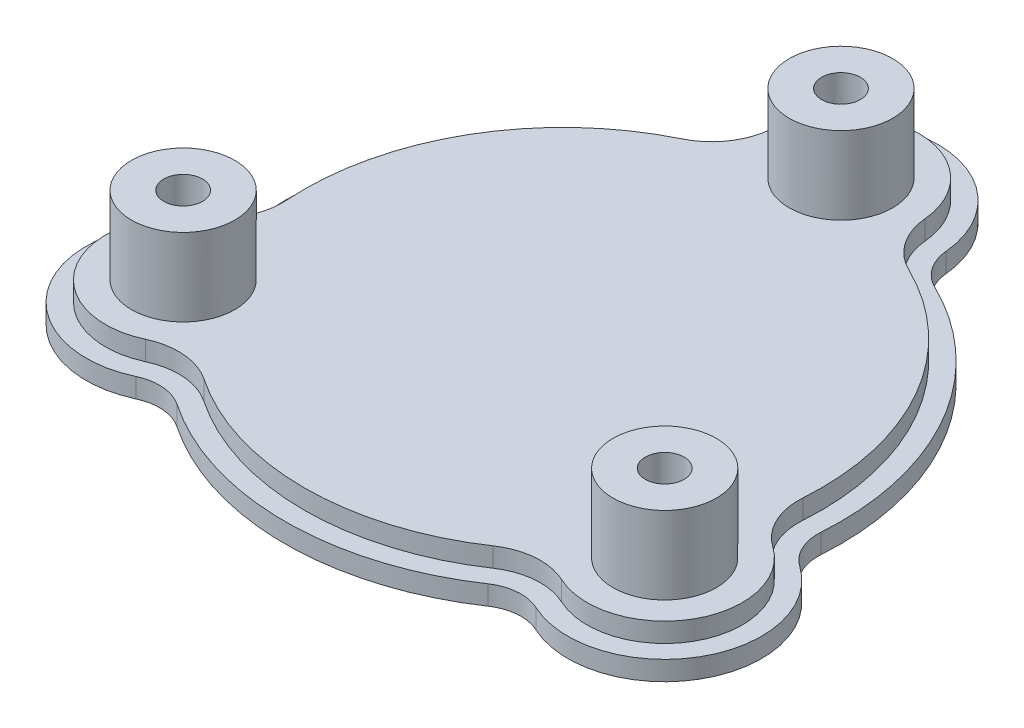
from build123d import *

# Parameters (mm, degrees)
SKETCH2_R             = 8
SKETCH2_R_2           = 3
BOSS_EXTRUDE2_DEPTH   = 6
BOSS_EXTRUDE2_2_DEPTH = 6
BOSS_EXTRUDE2_3_DEPTH = 6
SKETCH3_R             = 8
BOSS_EXTRUDE3_DEPTH   = 12
SKETCH3_4_R           = 8
CUT_EXTRUDE1_DEPTH    = 6
CUT_EXTRUDE3_DEPTH    = 9
SKETCH3_8_R           = 8
SKETCH3_8_R_2         = 6
BOSS_EXTRUDE4_DEPTH   = 12


with BuildPart() as part:
    # Sketch2 → Boss-Extrude2 (new body)
    with BuildSketch(Plane(origin=(0, 0, 0), x_dir=(1, 0, 0), z_dir=(0, 1, 0))):
        with Locations((0, 43)):
            Circle(SKETCH2_R)
        with Locations((0, 43)):
            Circle(SKETCH2_R_2, mode=Mode.SUBTRACT)
    extrude(amount=-BOSS_EXTRUDE2_DEPTH)



with BuildPart() as body_2:
    # Sketch2 → Boss-Extrude2 2 (new body)
    with BuildSketch(Plane(origin=(0, 0, 0), x_dir=(1, 0, 0), z_dir=(0, 1, 0))):
        with Locations((37.239092363, -21.5)):
            Circle(SKETCH2_R)
        with Locations((37.239092363, -21.5)):
            Circle(SKETCH2_R_2, mode=Mode.SUBTRACT)
    extrude(amount=-BOSS_EXTRUDE2_2_DEPTH)


with BuildPart() as body_3:
    # Sketch2 → Boss-Extrude2 3 (new body)
    with BuildSketch(Plane(origin=(0, 0, 0), x_dir=(1, 0, 0), z_dir=(0, 1, 0))):
        with Locations((-37.239092363, -21.5)):
            Circle(SKETCH2_R)
        with Locations((-37.239092363, -21.5)):
            Circle(SKETCH2_R_2, mode=Mode.SUBTRACT)
    extrude(amount=-BOSS_EXTRUDE2_3_DEPTH)


with BuildPart() as body_4:
    # Sketch3 → Boss-Extrude3 (new body)
    with BuildSketch(Plane.XZ.offset(6)):
        with BuildLine():
            ThreePointArc((-18.846153454, -38.65), (-16.147655157, -40.973517523), (-14.941453584, -44.323995772))
            ThreePointArc((-14.941453584, -44.323995772), (0, -58), (14.941453584, -44.323995772))
            ThreePointArc((14.941453584, -44.323995772), (16.147655157, -40.973517523), (18.846153454, -38.65))
            ThreePointArc((18.846153454, -38.65), (37.239092363, -21.5), (42.894958583, 3.003752345))
            ThreePointArc((42.894958583, 3.003752345), (43.557934635, 6.502479184), (45.856433127, 9.222319513))
            ThreePointArc((45.856433127, 9.222319513), (50.229473419, 29), (30.914979544, 35.101676259))
            ThreePointArc((30.914979544, 35.101676259), (27.410279478, 34.471038339), (24.048805129, 35.646247655))
            ThreePointArc((24.048805129, 35.646247655), (0, 43), (-24.048805129, 35.646247655))
            ThreePointArc((-24.048805129, 35.646247655), (-27.410279478, 34.471038339), (-30.914979544, 35.101676259))
            ThreePointArc((-30.914979544, 35.101676259), (-50.229473419, 29), (-45.856433127, 9.222319513))
            ThreePointArc((-45.856433127, 9.222319513), (-43.557934635, 6.502479184), (-42.894958583, 3.003752345))
            ThreePointArc((-42.894958583, 3.003752345), (-37.239092363, -21.5), (-18.846153454, -38.65))
        make_face()
        with Locations((0, -43)):
            Circle(SKETCH3_R, mode=Mode.SUBTRACT)
        with Locations((-37.239092363, 21.5)):
            Circle(SKETCH3_R, mode=Mode.SUBTRACT)
        with Locations((37.239092363, 21.5)):
            Circle(SKETCH3_R, mode=Mode.SUBTRACT)
    extrude(amount=BOSS_EXTRUDE3_DEPTH)

    # Sketch3<4> → Cut-Extrude1 (cut)
    with BuildSketch(Plane.XZ.offset(6)):
        with BuildLine():
            ThreePointArc((11.953162867, -44.059196617), (13.676307972, -39.272799119), (17.531305538, -35.953488372))
            ThreePointArc((17.531305538, -35.953488372), (34.641016151, -20), (39.902287054, 2.794188228))
            ThreePointArc((39.902287054, 2.794188228), (40.8493957, 7.792369426), (44.132964974, 11.67785561))
            ThreePointArc((44.132964974, 11.67785561), (47.631397208, 27.5), (32.179802107, 32.381341007))
            ThreePointArc((32.179802107, 32.381341007), (27.173087728, 31.480429693), (22.370981516, 33.159300144))
            ThreePointArc((22.370981516, 33.159300144), (0, 40), (-22.370981516, 33.159300144))
            ThreePointArc((-22.370981516, 33.159300144), (-27.173087728, 31.480429693), (-32.179802107, 32.381341007))
            ThreePointArc((-32.179802107, 32.381341007), (-47.631397208, 27.5), (-44.132964974, 11.67785561))
            ThreePointArc((-44.132964974, 11.67785561), (-40.8493957, 7.792369426), (-39.902287054, 2.794188228))
            ThreePointArc((-39.902287054, 2.794188228), (-34.641016151, -20), (-17.531305538, -35.953488372))
            ThreePointArc((-17.531305538, -35.953488372), (-13.676307972, -39.272799119), (-11.953162867, -44.059196617))
            ThreePointArc((-11.953162867, -44.059196617), (0, -55), (11.953162867, -44.059196617))
        make_face()
        with Locations((0, -43)):
            Circle(SKETCH3_4_R, mode=Mode.SUBTRACT)
        with Locations((-37.239092363, 21.5)):
            Circle(SKETCH3_4_R, mode=Mode.SUBTRACT)
        with Locations((37.239092363, 21.5)):
            Circle(SKETCH3_4_R, mode=Mode.SUBTRACT)
    extrude(amount=CUT_EXTRUDE1_DEPTH, mode=Mode.SUBTRACT)

    # Sketch3<6> → Cut-Extrude3 (cut)
    with BuildSketch(Plane.XZ.offset(6)):
        with BuildLine():
            ThreePointArc((-18.846153454, -38.65), (-16.147655157, -40.973517523), (-14.941453584, -44.323995772))
            ThreePointArc((-14.941453584, -44.323995772), (0, -58), (14.941453584, -44.323995772))
            ThreePointArc((14.941453584, -44.323995772), (16.147655157, -40.973517523), (18.846153454, -38.65))
            ThreePointArc((18.846153454, -38.65), (37.239092363, -21.5), (42.894958583, 3.003752345))
            ThreePointArc((42.894958583, 3.003752345), (43.557934635, 6.502479184), (45.856433127, 9.222319513))
            ThreePointArc((45.856433127, 9.222319513), (50.229473419, 29), (30.914979544, 35.101676259))
            ThreePointArc((30.914979544, 35.101676259), (27.410279478, 34.471038339), (24.048805129, 35.646247655))
            ThreePointArc((24.048805129, 35.646247655), (0, 43), (-24.048805129, 35.646247655))
            ThreePointArc((-24.048805129, 35.646247655), (-27.410279478, 34.471038339), (-30.914979544, 35.101676259))
            ThreePointArc((-30.914979544, 35.101676259), (-50.229473419, 29), (-45.856433127, 9.222319513))
            ThreePointArc((-45.856433127, 9.222319513), (-43.557934635, 6.502479184), (-42.894958583, 3.003752345))
            ThreePointArc((-42.894958583, 3.003752345), (-37.239092363, -21.5), (-18.846153454, -38.65))
        make_face()
        with BuildLine():
            ThreePointArc((39.902287054, 2.794188228), (34.641016151, -20), (17.531305538, -35.953488372))
            ThreePointArc((17.531305538, -35.953488372), (13.676307972, -39.272799119), (11.953162867, -44.059196617))
            ThreePointArc((11.953162867, -44.059196617), (0, -55), (-11.953162867, -44.059196617))
            ThreePointArc((-11.953162867, -44.059196617), (-13.676307972, -39.272799119), (-17.531305538, -35.953488372))
            ThreePointArc((-17.531305538, -35.953488372), (-34.641016151, -20), (-39.902287054, 2.794188228))
            ThreePointArc((-39.902287054, 2.794188228), (-40.8493957, 7.792369426), (-44.132964974, 11.67785561))
            ThreePointArc((-44.132964974, 11.67785561), (-47.631397208, 27.5), (-32.179802107, 32.381341007))
            ThreePointArc((-32.179802107, 32.381341007), (-27.173087728, 31.480429693), (-22.370981516, 33.159300144))
            ThreePointArc((-22.370981516, 33.159300144), (0, 40), (22.370981516, 33.159300144))
            ThreePointArc((22.370981516, 33.159300144), (27.173087728, 31.480429693), (32.179802107, 32.381341007))
            ThreePointArc((32.179802107, 32.381341007), (47.631397208, 27.5), (44.132964974, 11.67785561))
            ThreePointArc((44.132964974, 11.67785561), (40.8493957, 7.792369426), (39.902287054, 2.794188228))
        make_face(mode=Mode.SUBTRACT)
    extrude(amount=CUT_EXTRUDE3_DEPTH, mode=Mode.SUBTRACT)


with BuildPart() as part_1:
    add(part.part)

    add(body_2.part)  # Boss-Extrude4 merges body 2

    add(body_3.part)  # Boss-Extrude4 merges body 3

    add(body_4.part)  # Boss-Extrude4 merges body 4
    # Sketch3<8> → Boss-Extrude4 (add)
    # profile 1 of 3: a face of its own
    with BuildSketch(Plane.XZ.offset(6)):
        with Locations((0, -43)):
            Circle(SKETCH3_8_R)
        with Locations((0, -43)):
            Circle(SKETCH3_8_R_2, mode=Mode.SUBTRACT)
    # profile 2 of 3: a face of its own
    with BuildSketch(Plane.XZ.offset(6)):
        with Locations((-37.239092363, 21.5)):
            Circle(SKETCH3_8_R)
        with Locations((-37.239092363, 21.5)):
            Circle(SKETCH3_8_R_2, mode=Mode.SUBTRACT)
    # profile 3 of 3: a face of its own
    with BuildSketch(Plane.XZ.offset(6)):
        with Locations((37.239092363, 21.5)):
            Circle(SKETCH3_8_R)
        with Locations((37.239092363, 21.5)):
            Circle(SKETCH3_8_R_2, mode=Mode.SUBTRACT)
    extrude(amount=BOSS_EXTRUDE4_DEPTH)


solid = part_1.part
